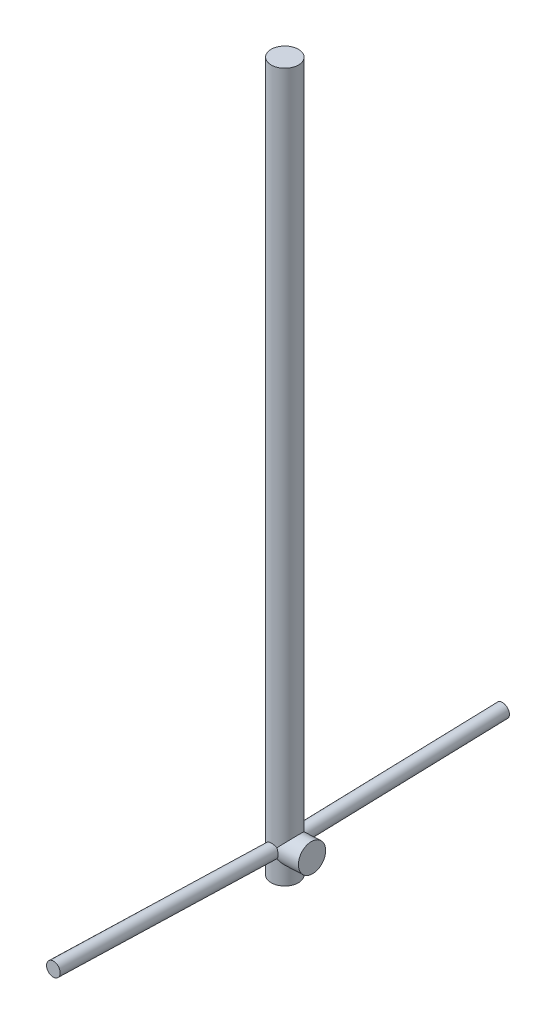
from build123d import *

# Parameters (mm, degrees)
SWEEP_100_PROFILE_R = 50
SWEEP_515_PROFILE_R = 25
SWEEP_585_PROFILE_R = 25
SWEEP_641_PROFILE_R = 50


with BuildPart() as part:
    # труба 100: sweep along a curve in space
    with BuildLine() as sweep_100_path:
        Line((0, -100, 0), (0, 2500, 0))
    # труба 100 profile (on start of the path) → труба 100 (sweep)
    with BuildSketch(Plane.ZX.offset(-100)):
        Circle(SWEEP_100_PROFILE_R)
    sweep(path=sweep_100_path.line)

    # Sweep 515: sweep along a curve in space
    with BuildLine() as sweep_515_path:
        Line((0, 25.5, 849.617413899), (0, 0, 0))
    # Sweep 515 profile (on start of the path) → Sweep 515 (sweep)
    with BuildSketch(Plane(origin=(0, 25.5, 849.617413899), x_dir=(0, -0.9995498987044119, 0.030000000000000002), z_dir=(0, -0.030000000000000002, -0.9995498987044119))):
        Circle(SWEEP_515_PROFILE_R)
    sweep(path=sweep_515_path.line)



with BuildPart() as body_2:
    # Sweep 585: sweep along a curve in space
    with BuildLine() as sweep_585_path:
        Line((0, 0, 0), (0, 24, -799.639918964))
    # Sweep 585 profile (on start of the path) → Sweep 585 (sweep)
    with BuildSketch(Plane(origin=(0, 0, 0), x_dir=(0, -0.9995498987044119, -0.03), z_dir=(0, 0.03, -0.9995498987044119))):
        Circle(SWEEP_585_PROFILE_R)
    sweep(path=sweep_585_path.line)


with BuildPart() as part_1:
    add(part.part)

    add(body_2.part)  # Sweep 641 merges body 2
    # Sweep 641: sweep along a curve in space
    with BuildLine() as sweep_641_path:
        Line((0, 0, 0), (99.874921777, 5, 0))
    # Sweep 641 profile (on start of the path) → Sweep 641 (sweep)
    with BuildSketch(Plane(origin=(0, 0, 0), x_dir=(-0.04999999999999999, 0.998749217771909, 0), z_dir=(0.998749217771909, 0.04999999999999999, 0))):
        Circle(SWEEP_641_PROFILE_R)
    sweep(path=sweep_641_path.line)


solid = part_1.part
